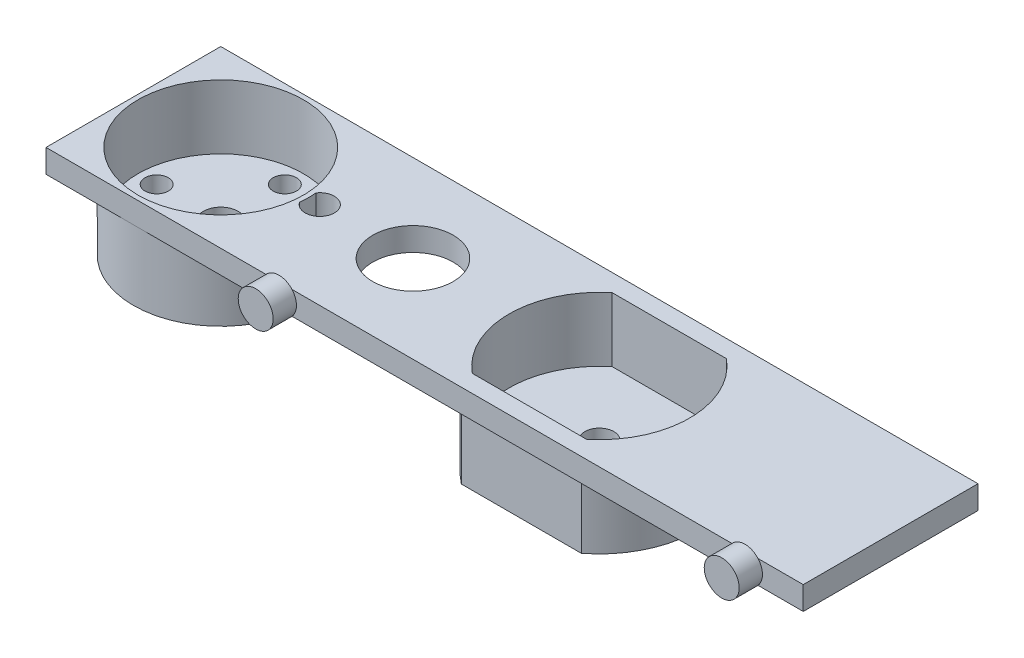
from build123d import *

# Parameters (mm, degrees)
SKETCH_1_W          = 65
SKETCH_1_H          = 15
EXTRUDE_1_DEPTH     = 2
SKETCH_2_R          = 1.25
SKETCH_2_R_2        = 3.45
SKETCH_2_R_3        = 1.5
SKETCH_2_R_4        = 1
CUT_EXTRUDE_1_DEPTH = 2
SKETCH_4_R          = 1.5
EXTRUDE_2_DEPTH     = 2
SKETCH_5_R          = 7.5
SKETCH_5_R_2        = 7.1
EXTRUDE_3_DEPTH     = 8
EXTRUDE_START       = -8
SKETCH_5_5_R        = 1.25
SKETCH_5_5_R_2      = 7.1
SKETCH_5_5_R_3      = 1
SKETCH_5_5_R_4      = 1.5
EXTRUDE_4_DEPTH     = 6
CUT_EXTRUDE_START   = -5.5
SKETCH_5_6_R        = 1.25
SKETCH_5_6_R_2      = 7.1
CUT_EXTRUDE_3_DEPTH = 5.5


with BuildPart() as part:
    # 草图1 → 凸台-拉伸1 (new body)
    with BuildSketch(Plane(origin=(0, 0, 0), x_dir=(1, 0, 0), z_dir=(0, 1, 0))):
        with Locations((-7.5, 0)):
            Rectangle(SKETCH_1_W, SKETCH_1_H)
    extrude(amount=EXTRUDE_1_DEPTH)

    # 草图2 → 切除-拉伸1 (cut)
    with BuildSketch(Plane(origin=(0, 0, 0), x_dir=(1, 0, 0), z_dir=(0, 1, 0))):
        with Locations(Location((0, 0, 0), (0, 0, 270))):
            Circle(SKETCH_2_R)
        with Locations(Location((-16, 0, 0), (0, 0, 90))):
            Circle(SKETCH_2_R_2)
        with Locations(Location((-24, 0, 0), (0, 0, 90))):
            Circle(SKETCH_2_R)
        with Locations(Location((-32.5, 0, 0), (0, 0, 270))):
            Circle(SKETCH_2_R_3)
        with Locations(Location((-27, 0, 0), (0, 0, 270))):
            Circle(SKETCH_2_R_4)
        with Locations(Location((-32.5, -5.5, 0), (0, 0, 270))):
            Circle(SKETCH_2_R_4)
        with Locations(Location((-38, 0, 0), (0, 0, 270))):
            Circle(SKETCH_2_R_4)
        with Locations(Location((-32.5, 5.5, 0), (0, 0, 270))):
            Circle(SKETCH_2_R_4)
    extrude(amount=CUT_EXTRUDE_1_DEPTH, mode=Mode.SUBTRACT)

    # 草图4 → 凸台-拉伸2 (add)
    with BuildSketch(Plane.XY.offset(7.5)):
        with Locations(Location((20, 1, 0), (0, 0, 221.810314896))):
            Circle(SKETCH_4_R)
        with Locations(Location((-20, 1, 0), (0, 0, 221.810314896))):
            Circle(SKETCH_4_R)
    extrude(amount=EXTRUDE_2_DEPTH)

    # 草图5 → 凸台-拉伸3 (add)
    # profile 1 of 2: a face of its own
    with BuildSketch(Plane(origin=(0, 2, 0), x_dir=(1, 0, 0), z_dir=(0, 1, 0))):
        with Locations(Location((-32.5, 0, 0), (0, 0, 270))):
            Circle(SKETCH_5_R)
        with Locations(Location((-32.5, 0, 0), (0, 0, 270))):
            Circle(SKETCH_5_R_2, mode=Mode.SUBTRACT)
    # profile 2 of 2: a face of its own
    with BuildSketch(Plane(origin=(0, 2, 0), x_dir=(1, 0, 0), z_dir=(0, 1, 0))):
        with BuildLine():
            Line((5.149029035, -6.7), (-5.149029035, -6.7))
            ThreePointArc((-5.149029035, -6.7), (-8.45, 0), (-5.149029035, 6.7))
            Line((-5.149029035, 6.7), (5.149029035, 6.7))
            ThreePointArc((5.149029035, 6.7), (8.45, 0), (5.149029035, -6.7))
        make_face()
        with BuildLine():
            Line((4.905354218, -6), (-4.905354218, -6))
            ThreePointArc((-4.905354218, -6), (-7.75, 0), (-4.905354218, 6))
            Line((-4.905354218, 6), (4.905354218, 6))
            ThreePointArc((4.905354218, 6), (7.75, 0), (4.905354218, -6))
        make_face(mode=Mode.SUBTRACT)
    extrude(amount=-EXTRUDE_3_DEPTH)

    # 草图5<5> → 凸台-拉伸4 (add)
    # profile 1 of 2: a face of its own
    with BuildSketch(Plane(origin=(0, 2, 0), x_dir=(1, 0, 0), z_dir=(0, 1, 0)).offset(EXTRUDE_START)):
        with BuildLine():
            Line((4.905354218, -6), (-4.905354218, -6))
            ThreePointArc((-4.905354218, -6), (-7.75, 0), (-4.905354218, 6))
            Line((-4.905354218, 6), (4.905354218, 6))
            ThreePointArc((4.905354218, 6), (7.75, 0), (4.905354218, -6))
        make_face()
        with Locations(Location((0, 0, 0), (0, 0, 270))):
            Circle(SKETCH_5_5_R, mode=Mode.SUBTRACT)
    # profile 2 of 2: a face of its own
    with BuildSketch(Plane(origin=(0, 2, 0), x_dir=(1, 0, 0), z_dir=(0, 1, 0)).offset(EXTRUDE_START)):
        with Locations((-32.5, 0)):
            Circle(SKETCH_5_5_R_2)
        with Locations(Location((-32.5, 5.5, 0), (0, 0, 270))):
            Circle(SKETCH_5_5_R_3, mode=Mode.SUBTRACT)
        with Locations(Location((-38, 0, 0), (0, 0, 270))):
            Circle(SKETCH_5_5_R_3, mode=Mode.SUBTRACT)
        with Locations(Location((-32.5, 0, 0), (0, 0, 270))):
            Circle(SKETCH_5_5_R_4, mode=Mode.SUBTRACT)
        with Locations(Location((-27, 0, 0), (0, 0, 270))):
            Circle(SKETCH_5_5_R_3, mode=Mode.SUBTRACT)
        with Locations(Location((-32.5, -5.5, 0), (0, 0, 270))):
            Circle(SKETCH_5_5_R_3, mode=Mode.SUBTRACT)
    extrude(amount=EXTRUDE_4_DEPTH)

    # 草图5<6> → 切除-拉伸3 (cut)
    # profile 1 of 2: a face of its own
    with BuildSketch(Plane(origin=(0, 2, 0), x_dir=(1, 0, 0), z_dir=(0, 1, 0)).offset(CUT_EXTRUDE_START)):
        with BuildLine():
            Line((4.905354218, -6), (-4.905354218, -6))
            ThreePointArc((-4.905354218, -6), (-7.75, 0), (-4.905354218, 6))
            Line((-4.905354218, 6), (4.905354218, 6))
            ThreePointArc((4.905354218, 6), (7.75, 0), (4.905354218, -6))
        make_face()
        with Locations(Location((0, 0, 0), (0, 0, 270))):
            Circle(SKETCH_5_6_R, mode=Mode.SUBTRACT)
    # profile 2 of 2: a face of its own
    with BuildSketch(Plane(origin=(0, 2, 0), x_dir=(1, 0, 0), z_dir=(0, 1, 0)).offset(CUT_EXTRUDE_START)):
        with Locations(Location((-32.5, 0, 0), (0, 0, 270))):
            Circle(SKETCH_5_6_R_2)
    extrude(amount=CUT_EXTRUDE_3_DEPTH, mode=Mode.SUBTRACT)


solid = part.part
